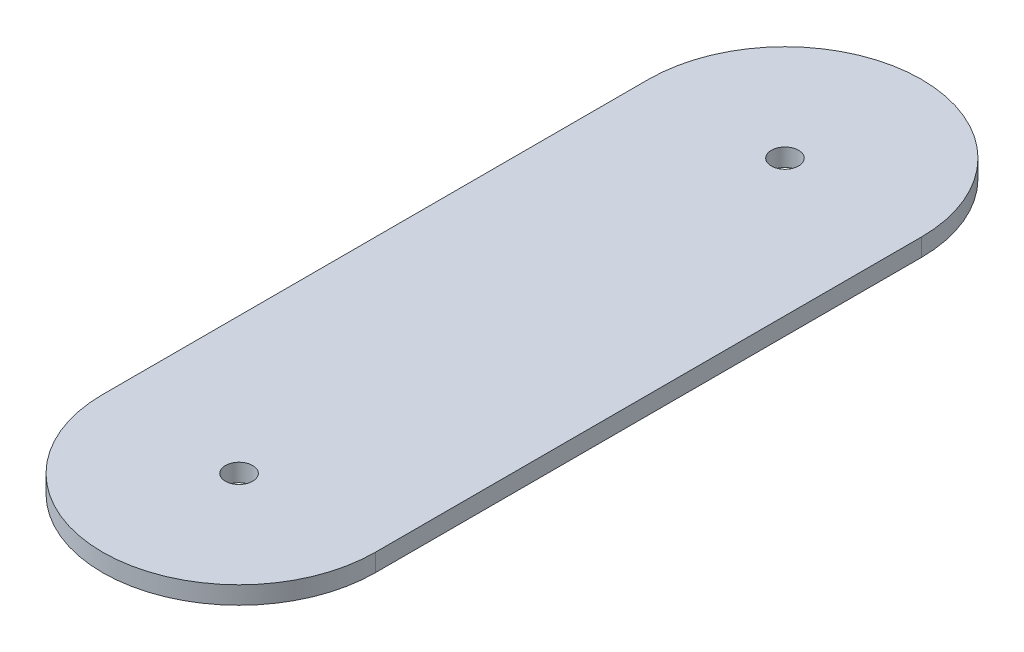
from build123d import *

# Parameters (mm, degrees)
SKETCH1_R           = 2.54
BOSS_EXTRUDE1_DEPTH = 3.302


with BuildPart() as part:
    # Sketch1 → Boss-Extrude1 (new body)
    with BuildSketch(Plane(origin=(0, 0, 0), x_dir=(1, 0, 0), z_dir=(0, 1, 0))):
        with BuildLine():
            Line((0, 0), (0, -101.6))
            ThreePointArc((0, -101.6), (25.4, -127), (50.8, -101.6))
            Line((50.8, -101.6), (50.8, 0))
            ThreePointArc((50.8, 0), (25.4, 25.4), (0, 0))
        make_face()
        with Locations(Location((25.4, 0, 0), (0, 0, 90))):
            Circle(SKETCH1_R, mode=Mode.SUBTRACT)
        with Locations(Location((25.4, -101.6, 0), (0, 0, 90))):
            Circle(SKETCH1_R, mode=Mode.SUBTRACT)
    extrude(amount=BOSS_EXTRUDE1_DEPTH)


solid = part.part
